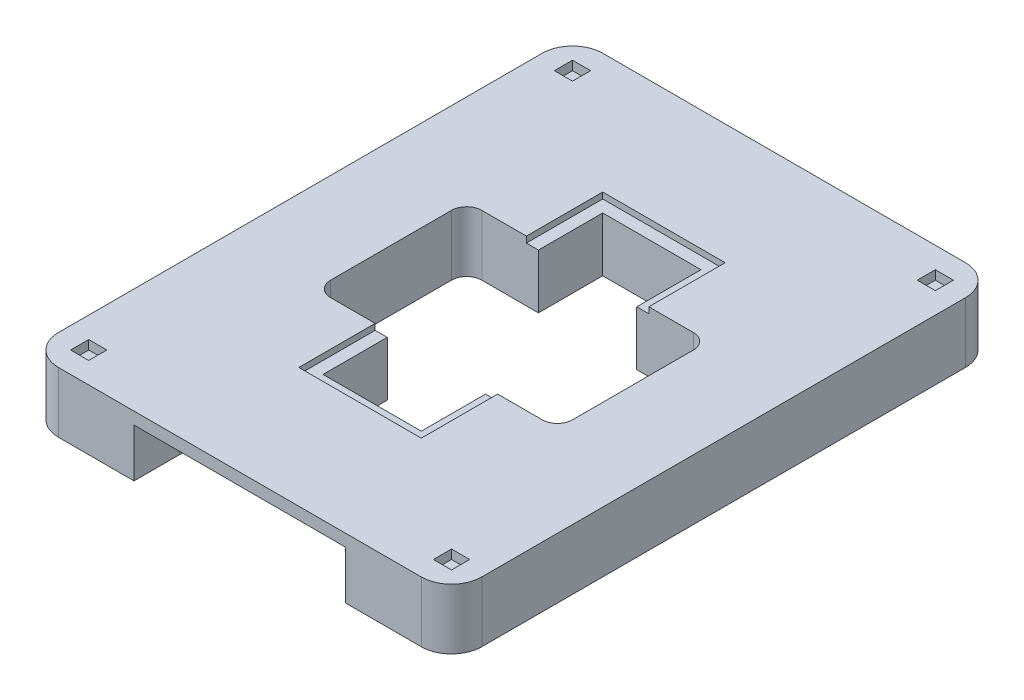
from build123d import *

# Parameters (mm, degrees)
SKETCH_1_W                                 = 200
SKETCH_1_H                                 = 200
EXTRUDE_1_DEPTH                            = 20
SKETCH_2_W                                 = 200
SKETCH_2_H                                 = 200
SKETCH_2_W_2                               = 140
SKETCH_2_H_2                               = 180
CUT_EXTRUDE_2_DEPTH                        = 143.828568571
FILLET_1_R                                 = 10
FILLET_2_R                                 = 10
FILLET_3_R                                 = 10
FILLET_4_R                                 = 10
CUT_EXTRUDE_4_DEPTH                        = 5
MIRROR_3_AT_THE_SECOND_PLANE_COPY_1_DEPTH  = 5
SKETCH_5_R                                 = 5
CUT_EXTRUDE_5_DEPTH                        = 6.2
CUT_EXTRUDE_7_DEPTH                        = 16
SKETCH_8_R                                 = 4.1
CUT_EXTRUDE_8_DEPTH                        = 4
DRAFT_2_ANGLE                              = 10
DRAFT_2_OF_MIRROR_10_2_ANGLE               = 10
DRAFT_2_OF_MIRROR_11_2_ANGLE               = 10
SKETCH_14_W                                = 6
SKETCH_14_H                                = 6
CUT_EXTRUDE_9_DEPTH                        = 3
MIRROR_12_AT_THE_SECOND_PLANE_COPY_1_SKE_W = 6
MIRROR_12_AT_THE_SECOND_PLANE_COPY_1_SKE_H = 6
MIRROR_12_AT_THE_SECOND_PLANE_COPY_1_DEPTH = 3
SKETCH_16_W                                = 40.5
SKETCH_16_H                                = 100.5
CUT_EXTRUDE_10_DEPTH                       = 2
SKETCH_17_W                                = 32.5
SKETCH_17_H                                = 92.5
CUT_EXTRUDE_11_DEPTH                       = 116.429632244
CUT_EXTRUDE_12_DEPTH                       = 116.758369028


with BuildPart() as part:
    # 草图1 → 凸台-拉伸1 (new body)
    with BuildSketch(Plane(origin=(0, 0, 0), x_dir=(1, 0, 0), z_dir=(0, 1, 0))):
        Rectangle(SKETCH_1_W, SKETCH_1_H)
    extrude(amount=EXTRUDE_1_DEPTH)

    # 草图2 → 切除-拉伸2 (cut, through all)
    with BuildSketch(Plane(origin=(0, 20, 0), x_dir=(1, 0, 0), z_dir=(0, 1, 0))):
        Rectangle(SKETCH_2_W, SKETCH_2_H)
        Rectangle(SKETCH_2_W_2, SKETCH_2_H_2, mode=Mode.SUBTRACT)
    extrude(amount=-CUT_EXTRUDE_2_DEPTH, mode=Mode.SUBTRACT)

    # 圆角1
    fillet_1_edges = [part.edges().sort_by_distance(p)[0] for p in [
        (-70, 10, -90),
    ]]
    fillet(fillet_1_edges, radius=FILLET_1_R)

    # 圆角2
    fillet_2_edges = [part.edges().sort_by_distance(p)[0] for p in [
        (70, 10, -90),
    ]]
    fillet(fillet_2_edges, radius=FILLET_2_R)

    # 圆角3
    fillet_3_edges = [part.edges().sort_by_distance(p)[0] for p in [
        (70, 10, 90),
    ]]
    fillet(fillet_3_edges, radius=FILLET_3_R)

    # 圆角4
    fillet_4_edges = [part.edges().sort_by_distance(p)[0] for p in [
        (-70, 10, 90),
    ]]
    fillet(fillet_4_edges, radius=FILLET_4_R)

    # 草图4 → 切除-拉伸4 (cut)
    with BuildSketch(Plane.XZ):
        with BuildLine():
            Line((-59.5, 84.974937186), (-59.5, 86))
            Line((-59.5, 86), (-60.5, 86))
            Line((-60.5, 86), (-60.5, 84.974937186))
            ThreePointArc((-60.5, 84.974937186), (-63.535533906, 83.535533906), (-64.974937186, 80.5))
            Line((-64.974937186, 80.5), (-66, 80.5))
            Line((-66, 80.5), (-66, 79.5))
            Line((-66, 79.5), (-64.974937186, 79.5))
            ThreePointArc((-64.974937186, 79.5), (-63.535533906, 76.464466094), (-60.5, 75.025062814))
            Line((-60.5, 75.025062814), (-60.5, 74))
            Line((-60.5, 74), (-59.5, 74))
            Line((-59.5, 74), (-59.5, 75.025062814))
            ThreePointArc((-59.5, 75.025062814), (-56.464466094, 76.464466094), (-55.025062814, 79.5))
            Line((-55.025062814, 79.5), (-54, 79.5))
            Line((-54, 79.5), (-54, 80.5))
            Line((-54, 80.5), (-55.025062814, 80.5))
            ThreePointArc((-55.025062814, 80.5), (-56.464466094, 83.535533906), (-59.5, 84.974937186))
        make_face()
    cut_extrude_4 = extrude(amount=-CUT_EXTRUDE_4_DEPTH, mode=Mode.SUBTRACT)

    # 镜向3: 切除-拉伸4 across plane
    add(cut_extrude_4.mirror(Plane(origin=(0, 0, 0), x_dir=(0, 0, 1), z_dir=(1, 0, 0))), mode=Mode.SUBTRACT)

    # 镜向3 at the second plane: 切除-拉伸4 across plane
    add(cut_extrude_4.mirror(Plane.XY), mode=Mode.SUBTRACT)

    # 镜向3 at the second plane copy 1 sket → 镜向3 at the second plane copy 1 (cut)
    with BuildSketch(Plane(origin=(0, 0, 0), x_dir=(-1, 0, 0), z_dir=(0, -1, 0))):
        with BuildLine():
            Line((-59.5, 84.974937186), (-59.5, 86))
            Line((-59.5, 86), (-60.5, 86))
            Line((-60.5, 86), (-60.5, 84.974937186))
            ThreePointArc((-60.5, 84.974937186), (-63.535533906, 83.535533906), (-64.974937186, 80.5))
            Line((-64.974937186, 80.5), (-66, 80.5))
            Line((-66, 80.5), (-66, 79.5))
            Line((-66, 79.5), (-64.974937186, 79.5))
            ThreePointArc((-64.974937186, 79.5), (-63.535533906, 76.464466094), (-60.5, 75.025062814))
            Line((-60.5, 75.025062814), (-60.5, 74))
            Line((-60.5, 74), (-59.5, 74))
            Line((-59.5, 74), (-59.5, 75.025062814))
            ThreePointArc((-59.5, 75.025062814), (-56.464466094, 76.464466094), (-55.025062814, 79.5))
            Line((-55.025062814, 79.5), (-54, 79.5))
            Line((-54, 79.5), (-54, 80.5))
            Line((-54, 80.5), (-55.025062814, 80.5))
            ThreePointArc((-55.025062814, 80.5), (-56.464466094, 83.535533906), (-59.5, 84.974937186))
        make_face()
    extrude(amount=-MIRROR_3_AT_THE_SECOND_PLANE_COPY_1_DEPTH, mode=Mode.SUBTRACT)

    # 草图5 → 切除-拉伸5 (cut)
    with BuildSketch(Plane.XZ):
        with Locations(Location((-60, 80, 0), (0, 0, 270))):
            Circle(SKETCH_5_R)
    extrude(amount=-CUT_EXTRUDE_5_DEPTH, mode=Mode.SUBTRACT)

    # 草图7 → 切除-拉伸7 (cut)
    with BuildSketch(Plane.XZ):
        with BuildLine():
            Line((35, 110), (-35, 110))
            Line((-35, 110), (-35, 75))
            ThreePointArc((-35, 75), (-33.535533906, 71.464466094), (-30, 70))
            Line((-30, 70), (30, 70))
            ThreePointArc((30, 70), (33.535533906, 71.464466094), (35, 75))
            Line((35, 75), (35, 110))
        make_face()
    cut_extrude_7 = extrude(amount=-CUT_EXTRUDE_7_DEPTH, mode=Mode.SUBTRACT)

    # 镜向6: 切除-拉伸7 across plane
    add(cut_extrude_7.mirror(Plane.XY), mode=Mode.SUBTRACT)

    # 草图8 → 切除-拉伸8 (cut)
    with BuildSketch(Plane.XZ):
        with Locations(Location((-40.5, 40.5, 0), (0, 0, 270))):
            Circle(SKETCH_8_R)
    cut_extrude_8 = extrude(amount=-CUT_EXTRUDE_8_DEPTH, mode=Mode.SUBTRACT)

    # 拔模2
    draft_2_faces = [part.faces().sort_by_distance(p)[0] for p in [
        (-40.5, 2, 44.6),
    ]]
    draft(draft_2_faces, Plane(origin=(-40.5, 4, 40.5), x_dir=(0, 0, -1), z_dir=(0, -1, 0)), DRAFT_2_ANGLE)

    # 镜向10: 切除-拉伸8 across plane
    add(cut_extrude_8.mirror(Plane(origin=(0, 0, 0), x_dir=(0, 0, 1), z_dir=(1, 0, 0))), mode=Mode.SUBTRACT)

    # 拔模2 of Mirror 10 2
    draft_2_of_mirror_10_2_faces = [part.faces().sort_by_distance(p)[0] for p in [
        (40.5, 2, 44.6),
    ]]
    draft(draft_2_of_mirror_10_2_faces, Plane(origin=(40.5, 4, 40.5), x_dir=(0, 0, -1), z_dir=(0, -1, 0)), DRAFT_2_OF_MIRROR_10_2_ANGLE)

    # 镜向11: 切除-拉伸8 across plane
    add(cut_extrude_8.mirror(Plane.XY), mode=Mode.SUBTRACT)

    # 拔模2 of Mirror 11 2
    draft_2_of_mirror_11_2_faces = [part.faces().sort_by_distance(p)[0] for p in [
        (-40.5, 2, -44.6),
    ]]
    draft(draft_2_of_mirror_11_2_faces, Plane(origin=(-40.5, 4, -40.5), x_dir=(0, 0, 1), z_dir=(0, -1, 0)), DRAFT_2_OF_MIRROR_11_2_ANGLE)

    # 草图14 → 切除-拉伸9 (cut)
    with BuildSketch(Plane(origin=(0, 20, 0), x_dir=(1, 0, 0), z_dir=(0, 1, 0))):
        with Locations((-60, 80)):
            Rectangle(SKETCH_14_W, SKETCH_14_H)
    cut_extrude_9 = extrude(amount=-CUT_EXTRUDE_9_DEPTH, mode=Mode.SUBTRACT)

    # 镜向12: 切除-拉伸9 across plane
    add(cut_extrude_9.mirror(Plane(origin=(0, 0, 0), x_dir=(0, 0, 1), z_dir=(1, 0, 0))), mode=Mode.SUBTRACT)

    # 镜向12 at the second plane: 切除-拉伸9 across plane
    add(cut_extrude_9.mirror(Plane.XY), mode=Mode.SUBTRACT)

    # 镜向12 at the second plane copy 1 ske → 镜向12 at the second plane copy 1 (cut)
    with BuildSketch(Plane(origin=(0, 20, 0), x_dir=(-1, 0, 0), z_dir=(0, 1, 0))):
        with Locations((-60, 80)):
            Rectangle(MIRROR_12_AT_THE_SECOND_PLANE_COPY_1_SKE_W, MIRROR_12_AT_THE_SECOND_PLANE_COPY_1_SKE_H)
    extrude(amount=-MIRROR_12_AT_THE_SECOND_PLANE_COPY_1_DEPTH, mode=Mode.SUBTRACT)

    # 草图16 → 切除-拉伸10 (cut)
    with BuildSketch(Plane(origin=(0, 20, 0), x_dir=(1, 0, 0), z_dir=(0, 1, 0))):
        Rectangle(SKETCH_16_W, SKETCH_16_H)
    extrude(amount=-CUT_EXTRUDE_10_DEPTH, mode=Mode.SUBTRACT)

    # 草图17 → 切除-拉伸11 (cut, through all)
    with BuildSketch(Plane(origin=(0, 18, 0), x_dir=(1, 0, 0), z_dir=(0, 1, 0))):
        Rectangle(SKETCH_17_W, SKETCH_17_H)
    extrude(amount=-CUT_EXTRUDE_11_DEPTH, mode=Mode.SUBTRACT)

    # 草图18 → 切除-拉伸12 (cut, through all)
    with BuildSketch(Plane(origin=(0, 20, 0), x_dir=(1, 0, 0), z_dir=(0, 1, 0))):
        with BuildLine():
            Line((35, -25), (-35, -25))
            ThreePointArc((-35, -25), (-38.535533906, -23.535533906), (-40, -20))
            Line((-40, -20), (-40, 20))
            ThreePointArc((-40, 20), (-38.535533906, 23.535533906), (-35, 25))
            Line((-35, 25), (35, 25))
            ThreePointArc((35, 25), (38.535533906, 23.535533906), (40, 20))
            Line((40, 20), (40, -20))
            ThreePointArc((40, -20), (38.535533906, -23.535533906), (35, -25))
        make_face()
    extrude(amount=-CUT_EXTRUDE_12_DEPTH, mode=Mode.SUBTRACT)


solid = part.part
